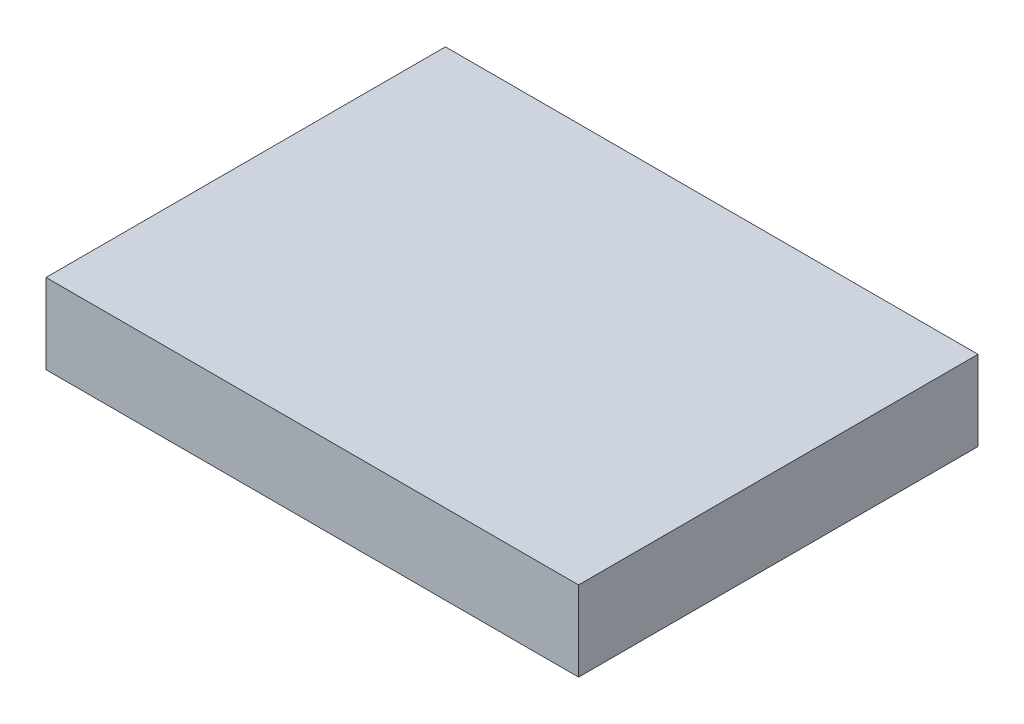
from build123d import *

# Parameters (mm, degrees)
SKETCH1_W           = 20
SKETCH1_H           = 15
BOSS_EXTRUDE1_DEPTH = 3


with BuildPart() as part:
    # Sketch1 → Boss-Extrude1 (new body)
    with BuildSketch(Plane(origin=(0, 0, 0), x_dir=(1, 0, 0), z_dir=(0, 1, 0))):
        Rectangle(SKETCH1_W, SKETCH1_H)
    extrude(amount=BOSS_EXTRUDE1_DEPTH)


solid = part.part
